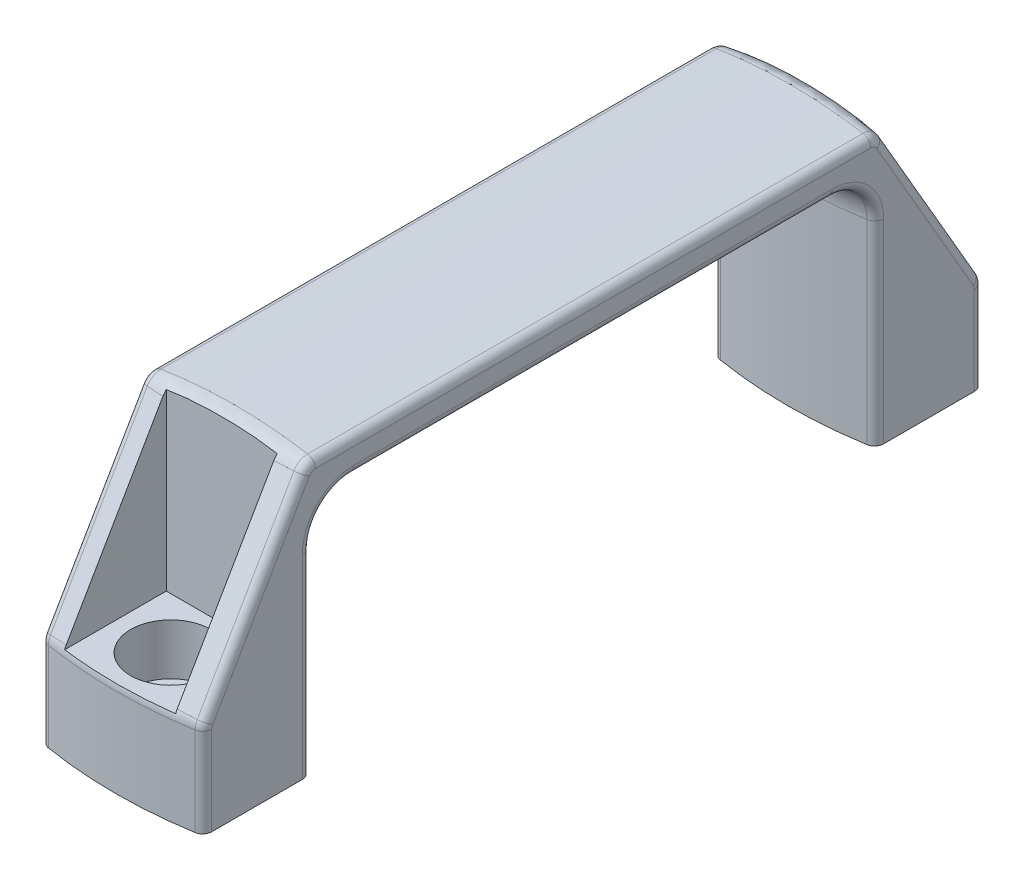
from build123d import *

# Parameters (mm, degrees)
BOSS_EXTRUDE1_DEPTH         = 11.1125
CUT_EXTRUDE1_DEPTH          = 7.6125
CUT_EXTRUDE1_DEPTH_BACK     = 7.6125
FILLET1_R                   = 5
CBORE_FOR_SHCS1_D           = 6.4
CBORE_FOR_SHCS1_CBORE_D     = 11
CBORE_FOR_SHCS1_CBORE_DEPTH = 7
FILLET2_R                   = 1.25


with BuildPart() as part:
    # Sketch1 → Boss-Extrude1 (new, symmetric)
    with BuildSketch(Plane(origin=(0, 0, 0), x_dir=(0, 0, -1), z_dir=(1, 0, 0))):
        Polygon((-39.83125, 38.1), (-39.83125, 13), (-54.371875, 13), (-54.371875, 0), (-37.83125, 0), (-37.83125, 31.75), (0, 31.75), (0, 38.1), align=None)
        Polygon((-39.83125, 13), (-54.371875, 13), (-39.83125, 38.1), align=None)
    extrude(amount=BOSS_EXTRUDE1_DEPTH, both=True)

    # Sketch1<3> → Cut-Extrude1 (cut, two sides: drawn at the far end of the back side and taken through both)
    with BuildSketch(Plane(origin=(0, 0, 0), x_dir=(0, 0, -1), z_dir=(1, 0, 0)).offset(-CUT_EXTRUDE1_DEPTH_BACK)):
        Polygon((-39.83125, 13), (-54.371875, 13), (-39.83125, 38.1), align=None)
    extrude(amount=CUT_EXTRUDE1_DEPTH + CUT_EXTRUDE1_DEPTH_BACK, mode=Mode.SUBTRACT)

    # Fillet1
    fillet1_edges = [part.edges().sort_by_distance(p)[0] for p in [
        (0, 31.75, 37.83125),
    ]]
    fillet(fillet1_edges, radius=FILLET1_R)

    # CBORE for  SHCS1 (through all)
    with Locations(Plane(origin=(0, 13, 0), x_dir=(1, 0, 0), z_dir=(0, 1, 0))):
        with Locations((0, -46.83125)):
            CounterBoreHole(CBORE_FOR_SHCS1_D / 2, CBORE_FOR_SHCS1_CBORE_D / 2, CBORE_FOR_SHCS1_CBORE_DEPTH)

    # Cut-Sweep1: sweep along a path in Sketch5
    with BuildLine(Plane(origin=(0, 0, 0), x_dir=(0, 0, -1), z_dir=(1, 0, 0))) as cut_sweep1_path:
        Line((0, 38.1), (-38.102131712, 38.1))
        ThreePointArc((-38.102131712, 38.1), (-39.600225775, 37.699175673), (-40.698004808, 36.603809452))
        Line((-40.698004808, 36.603809452), (-53.967748096, 13.697603114))
        ThreePointArc((-53.967748096, 13.697603114), (-54.269082215, 12.972375935), (-54.371875, 12.193793662))
        Line((-54.371875, 12.193793662), (-54.371875, 0))
    # Sketch4 → Cut-Sweep1 (sweep, cut)
    with BuildSketch(Plane(origin=(0, 0, 0), x_dir=(-1, 0, 0), z_dir=(0, 0, -1))):
        with BuildLine():
            Line((-11.1125, 37.1), (-11.1125, 48.1))
            Line((-11.1125, 48.1), (11.1125, 48.1))
            Line((11.1125, 48.1), (11.1125, 37.1))
            ThreePointArc((11.1125, 37.1), (0, 38.1), (-11.1125, 37.1))
        make_face()
    sweep(path=cut_sweep1_path.line, mode=Mode.SUBTRACT)

    # Cut-Sweep3: sweep along a path in Sketch7
    with BuildLine(Plane(origin=(0, 0, 0), x_dir=(0, 0, -1), z_dir=(1, 0, 0))) as cut_sweep3_path:
        Line((0, 31.75), (-32.83125, 31.75))
        ThreePointArc((-32.83125, 31.75), (-36.366783906, 30.285533906), (-37.83125, 26.75))
        Line((-37.83125, 26.75), (-37.83125, 0))
    # Sketch6 → Cut-Sweep3 (sweep, cut)
    with BuildSketch(Plane(origin=(0, 0, 0), x_dir=(-1, 0, 0), z_dir=(0, 0, -1))):
        with BuildLine():
            Line((-11.1125, 30.75), (-11.1125, 32.75))
            ThreePointArc((-11.1125, 32.75), (0, 31.75), (11.1125, 32.75))
            Line((11.1125, 32.75), (11.1125, 30.75))
            Line((11.1125, 30.75), (-11.1125, 30.75))
        make_face()
    sweep(path=cut_sweep3_path.line, mode=Mode.SUBTRACT)

    # Fillet2
    fillet2_edges = [part.edges().sort_by_distance(p)[0] for p in [
        (-11.1125, 13.375, 38.83125),
        (11.1125, 32.75, 16.415625),
        (-11.1125, 30.992640687, 37.073890687),
        (11.1125, 30.992640687, 37.073890687),
        (11.1125, 13.375, 38.83125),
        (-11.1125, 32.75, 16.415625),
        (11.1125, 37.1, 19.051065856),
        (-11.1125, 36.832783782, 39.100861087),
        (-11.1125, 24.649436466, 46.46758542),
        (-11.1125, 12.712848511, 53.303346476),
        (-11.1125, 6.096896831, 53.371875),
        (11.1125, 6.096896831, 53.371875),
        (-11.1125, 37.1, 19.051065856),
        (11.1125, 12.712848511, 53.303346476),
        (11.1125, 24.649436466, 46.46758542),
        (11.1125, 36.832783782, 39.100861087),
    ]]
    fillet(fillet2_edges, radius=FILLET2_R)

    # Mirror1: part across plane


with BuildPart() as part_1:
    add(part.part)
    add(part.part.mirror(Plane.XY))


solid = part_1.part
